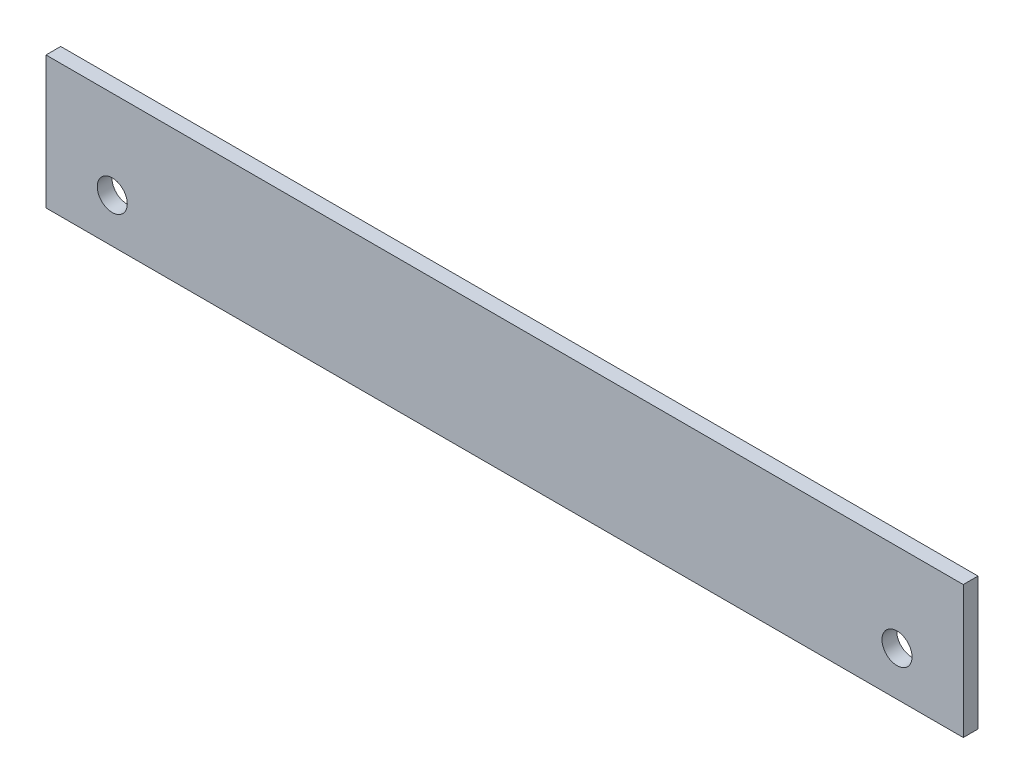
from build123d import *

# Parameters (mm, degrees)
SKETCH1_W                    = 311.5
SKETCH1_H                    = 45
BOSS_EXTRUDE1_DEPTH          = 2.5
F_10_2_10_2_DIAMETER_HOLE1_D = 10.2


with BuildPart() as part:
    # Sketch1 → Boss-Extrude1 (new, symmetric)
    with BuildSketch(Plane.XY):
        Rectangle(SKETCH1_W, SKETCH1_H)
    extrude(amount=BOSS_EXTRUDE1_DEPTH, both=True)

    # Ø10.2 (10.2) Diameter Hole1 (through all)
    with Locations(Plane.XY.offset(2.5)):
        with Locations((-133.249958454, -7.5), (133.249998631, -7.5)):
            Hole(F_10_2_10_2_DIAMETER_HOLE1_D / 2)


solid = part.part
